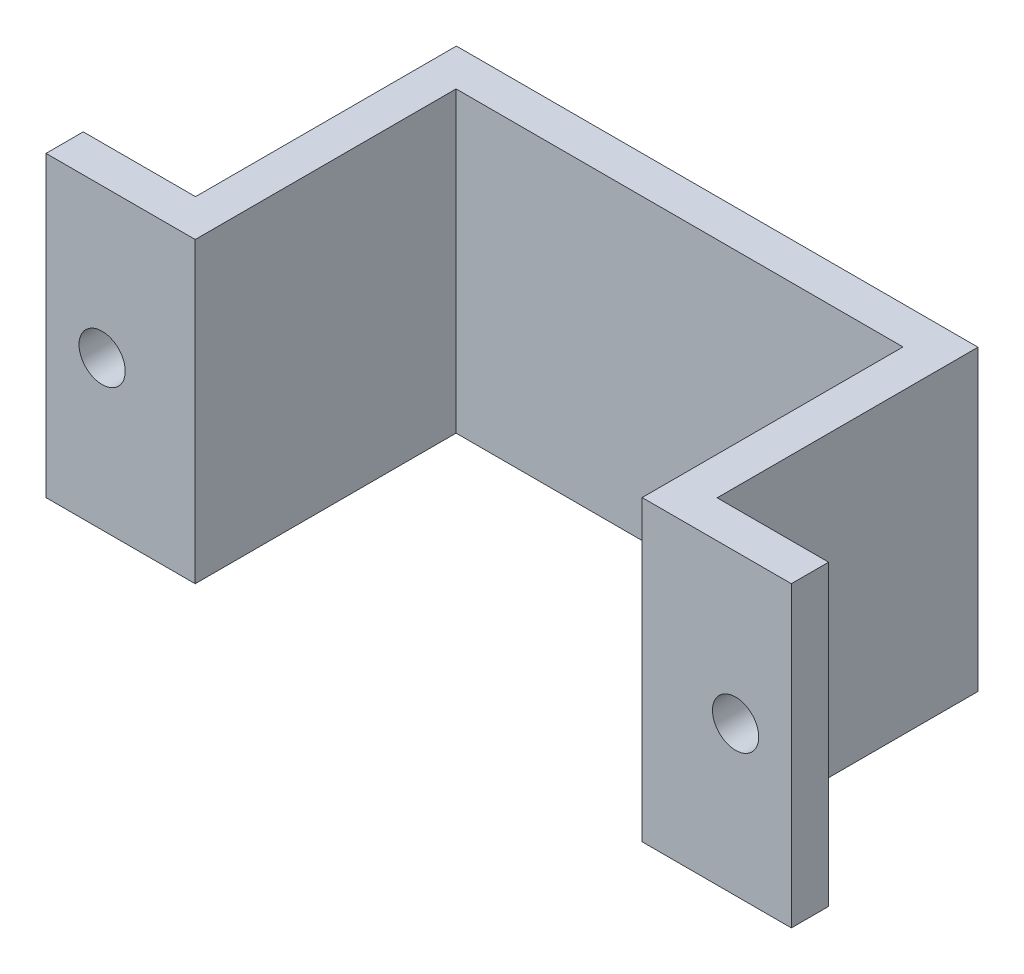
from build123d import *

# Parameters (mm, degrees)
SKETCH1_W           = 127
SKETCH1_H           = 50.8
BOSS_EXTRUDE1_DEPTH = 50.8
SKETCH2_W           = 18.996127276
SKETCH2_H           = 50.8
SKETCH2_W_2         = 19.127407137
CUT_EXTRUDE1_DEPTH  = 44.45
SKETCH3_W           = 76.151334044
SKETCH3_H           = 50.8
CUT_EXTRUDE2_DEPTH  = 44.45
SKETCH5_R           = 3.937
CUT_EXTRUDE4_DEPTH  = 44.45
SKETCH6_R           = 3.937
CUT_EXTRUDE5_DEPTH  = 44.45


with BuildPart() as part:
    # Sketch1 → Boss-Extrude1 (new body)
    with BuildSketch(Plane.XY):
        Rectangle(SKETCH1_W, SKETCH1_H)
    extrude(amount=BOSS_EXTRUDE1_DEPTH)

    # Sketch2 → Cut-Extrude1 (cut)
    with BuildSketch(Plane(origin=(0, 0, 0), x_dir=(-1, 0, 0), z_dir=(0, 0, -1))):
        with Locations((-54.001936362, 0)):
            Rectangle(SKETCH2_W, SKETCH2_H)
        with Locations((53.936296432, 0)):
            Rectangle(SKETCH2_W_2, SKETCH2_H)
    extrude(amount=-CUT_EXTRUDE1_DEPTH, mode=Mode.SUBTRACT)

    # Sketch3 → Cut-Extrude2 (cut)
    with BuildSketch(Plane.XY.offset(50.8)):
        Rectangle(SKETCH3_W, SKETCH3_H)
    extrude(amount=-CUT_EXTRUDE2_DEPTH, mode=Mode.SUBTRACT)

    # Sketch5 → Cut-Extrude4 (cut)
    with BuildSketch(Plane(origin=(0, 0, 44.45), x_dir=(-1, 0, 0), z_dir=(0, 0, -1))):
        with Locations((-54.001936362, 0)):
            Circle(SKETCH5_R)
    extrude(amount=-CUT_EXTRUDE4_DEPTH, mode=Mode.SUBTRACT)

    # Sketch6 → Cut-Extrude5 (cut)
    with BuildSketch(Plane(origin=(0, 0, 44.45), x_dir=(-1, 0, 0), z_dir=(0, 0, -1))):
        with Locations((53.936296432, 0)):
            Circle(SKETCH6_R)
    extrude(amount=-CUT_EXTRUDE5_DEPTH, mode=Mode.SUBTRACT)


solid = part.part
